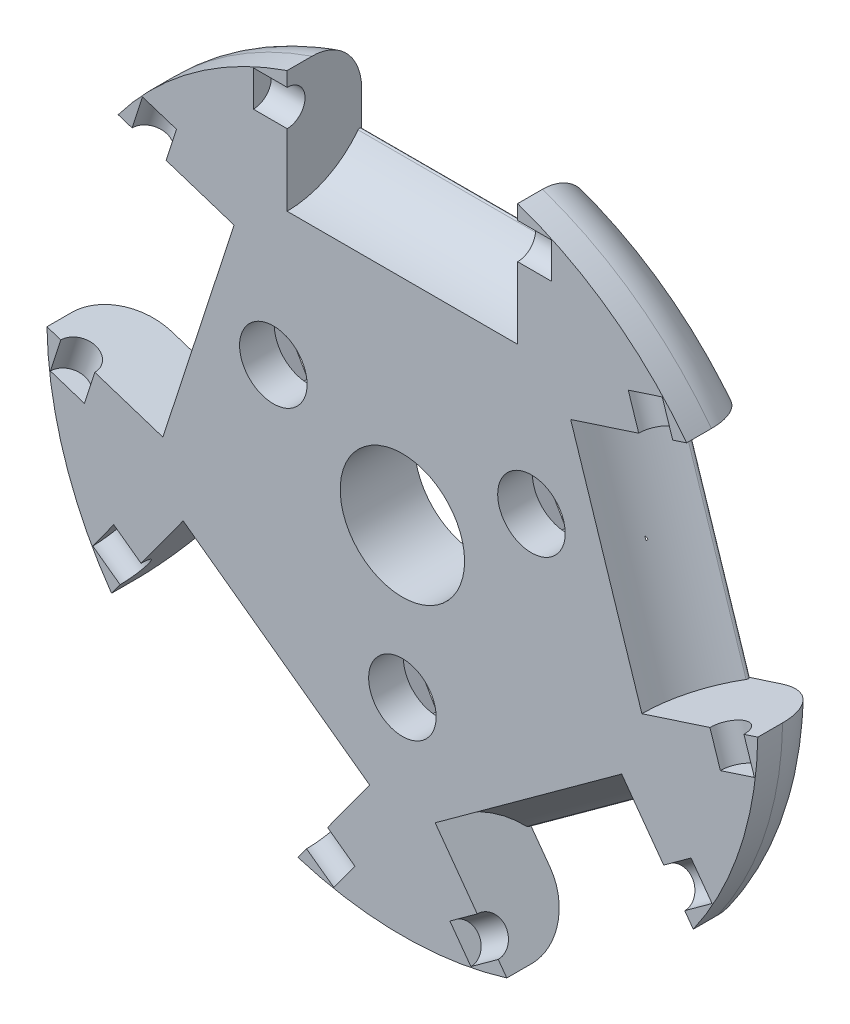
from build123d import *

# Parameters (mm, degrees)
SKETCH1_R                = 22.7203
BOSS_EXTRUDE2_DEPTH      = 4.7625
FILLET1_R                = 3.175
SKETCH2_W                = 14.732
SKETCH2_H                = 10.414
CUT_EXTRUDE2_DEPTH       = 12.7
CIRPATTERN1_COUNT        = 5
SKETCH4_R                = 1.143
CUT_EXTRUDE4_DEPTH       = 9.525
CIRPATTERN2_COUNT        = 5
SKETCH5_R                = 3.9751
CUT_EXTRUDE5_DEPTH       = 33.480350535
SKETCH6_R                = 2.159
CUT_EXTRUDE7_DEPTH       = 33.480350535
BOSS_EXTRUDE4_REACH      = 39.999
FILLET2_R                = 0.127
CIRPATTERN5_COUNT        = 5
FILLET2_OF_CIRPATTERN5_R = 0.127
CUT_EXTRUDE8_DEPTH       = 2.54


with BuildPart() as part:
    # Sketch1 → Boss-Extrude2 (new body)
    with BuildSketch(Plane.XY):
        Circle(SKETCH1_R)
    extrude(amount=-BOSS_EXTRUDE2_DEPTH)

    # Fillet1
    fillet1_edges = [part.edges().sort_by_distance(p)[0] for p in [
        (-22.7203, 0, -4.7625),
    ]]
    fillet(fillet1_edges, radius=FILLET1_R)

    # Sketch2 → Cut-Extrude2 (cut)
    with BuildSketch(Plane.XY):
        with Locations((0, 18.7833)):
            Rectangle(SKETCH2_W, SKETCH2_H)
    cut_extrude2 = extrude(amount=-CUT_EXTRUDE2_DEPTH, mode=Mode.SUBTRACT)

    # CirPattern1: Cut-Extrude2 ×5 about axis
    cirpattern1_axis = Axis((0, 0, 0), (0, 0, 1))
    for i in range(1, CIRPATTERN1_COUNT):
        add(cut_extrude2.rotate(cirpattern1_axis, i * 360 / CIRPATTERN1_COUNT), mode=Mode.SUBTRACT)

    # Sketch4 → Cut-Extrude4 (cut, symmetric)
    with BuildSketch(Plane(origin=(0, 0, 0), x_dir=(0, 0, -1), z_dir=(1, 0, 0))):
        with Locations((0, 19.4183)):
            Circle(SKETCH4_R)
    cut_extrude4 = extrude(amount=CUT_EXTRUDE4_DEPTH, both=True, mode=Mode.SUBTRACT)

    # CirPattern2: Cut-Extrude4 ×5 about axis
    cirpattern2_axis = Axis((0, 0, 0), (0, 0, 1))
    for i in range(1, CIRPATTERN2_COUNT):
        add(cut_extrude4.rotate(cirpattern2_axis, i * 360 / CIRPATTERN2_COUNT), mode=Mode.SUBTRACT)

    # Sketch5 → Cut-Extrude5 (cut, through all)
    with BuildSketch(Plane.XY):
        Circle(SKETCH5_R)
    extrude(amount=-CUT_EXTRUDE5_DEPTH, mode=Mode.SUBTRACT)

    # Sketch6 → Cut-Extrude7 (cut, through all)
    with BuildSketch(Plane(origin=(0, 0, -4.7625), x_dir=(-1, 0, 0), z_dir=(0, 0, -1))):
        with Locations((0, -9.525)):
            Circle(SKETCH6_R)
        with Locations((-8.248891971, 4.7625)):
            Circle(SKETCH6_R)
        with Locations((8.248891971, 4.7625)):
            Circle(SKETCH6_R)
    extrude(amount=-CUT_EXTRUDE7_DEPTH, mode=Mode.SUBTRACT)

    # Sketch10 → Boss-Extrude4 (add, up to next)
    with BuildSketch(Plane.ZY.offset(-7.366), mode=Mode.PRIVATE) as boss_extrude4_sk1:
        with BuildLine():
            Line((-4.7625, 13.5763), (0, 13.5763))
            Line((0, 13.5763), (0, 13.7033))
            ThreePointArc((0, 13.7033), (-2.7025038, 14.38265722), (-4.7625, 16.259214887))
            Line((-4.7625, 16.259214887), (-4.7625, 13.5763))
        make_face()
    boss_extrude4_tool1 = extrude(boss_extrude4_sk1.sketch, amount=BOSS_EXTRUDE4_REACH, mode=Mode.PRIVATE) - part.part
    boss_extrude4 = boss_extrude4_tool1.solids().sort_by_distance((7.366, 14.314807, -3.452063))[0]
    add(boss_extrude4)

    # Fillet2
    fillet2_edges = [part.edges().sort_by_distance(p)[0] for p in [
        (0, 16.259214887, -4.7625),
    ]]
    fillet(fillet2_edges, radius=FILLET2_R)

    # CirPattern5: Boss-Extrude4 ×5 about axis
    cirpattern5_axis = Axis((0, 0, 0), (0, 0, 1))
    for i in range(1, CIRPATTERN5_COUNT):
        add(boss_extrude4.rotate(cirpattern5_axis, i * 360 / CIRPATTERN5_COUNT))

    # Fillet2 of CirPattern5
    fillet2_of_cirpattern5_edges = [part.edges().sort_by_distance(p)[0] for p in [
        (-15.463432268, 5.024373715, -4.7625),
        (-9.556926725, -13.153981159, -4.7625),
        (9.556926725, -13.153981159, -4.7625),
        (15.463432268, 5.024373715, -4.7625),
    ]]
    fillet(fillet2_of_cirpattern5_edges, radius=FILLET2_OF_CIRPATTERN5_R)

    # Sketch7 → Cut-Extrude8 (cut)
    with BuildSketch(Plane(origin=(0, 0, -4.7625), x_dir=(-1, 0, 0), z_dir=(0, 0, -1))):
        Polygon((-10.815213918, 0.3175), (-5.682570024, 0.3175), (-3.116248078, 4.7625), (-5.682570024, 9.2075), (-10.815213918, 9.2075), (-13.381535864, 4.7625), align=None)
        Polygon((5.132643893, -9.525), (2.566321947, -5.08), (-2.566321947, -5.08), (-5.132643893, -9.525), (-2.566321947, -13.97), (2.566321947, -13.97), align=None)
        Polygon((5.682570024, 9.2075), (3.116248078, 4.7625), (5.682570024, 0.3175), (10.815213918, 0.3175), (13.381535864, 4.7625), (10.815213918, 9.2075), align=None)
    extrude(amount=-CUT_EXTRUDE8_DEPTH, mode=Mode.SUBTRACT)


solid = part.part
